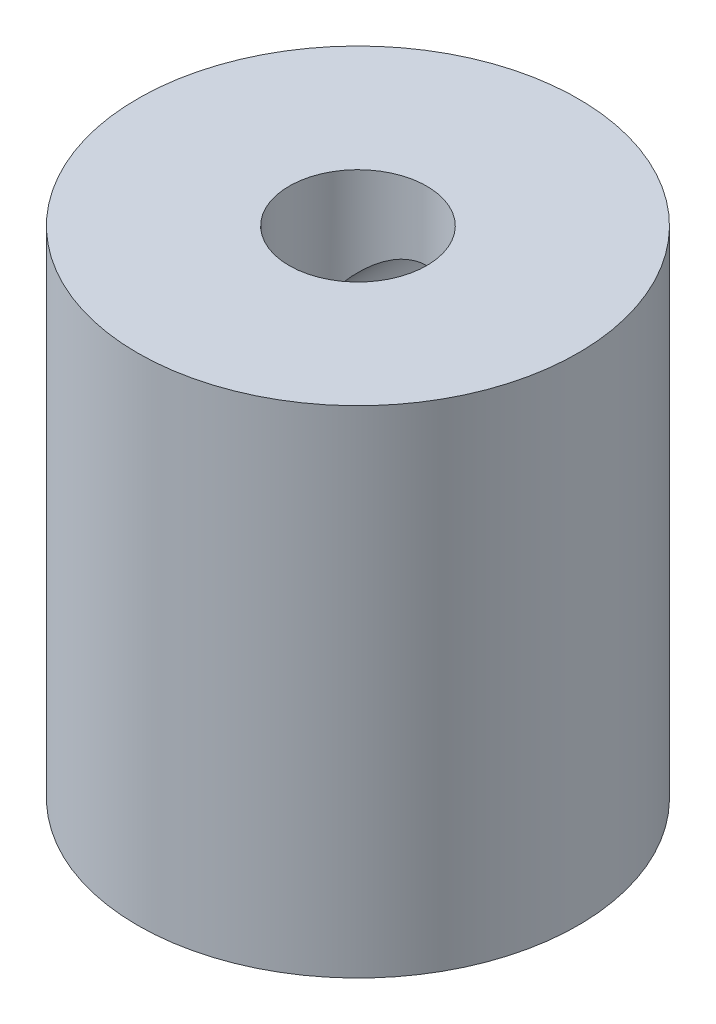
from build123d import *

# Parameters (mm, degrees)
ESBO_O1_R                = 4
ESBO_O1_R_2              = 1.25
RESSALTO_EXTRUS_O1_DEPTH = 9
ESBO_O2_R                = 1.25
CORTE_EXTRUS_O1_DEPTH    = 9


with BuildPart() as part:
    # Esboço1 → Ressalto-extrusão1 (new body)
    with BuildSketch(Plane(origin=(0, 0, 0), x_dir=(1, 0, 0), z_dir=(0, 1, 0))):
        with Locations(Location((0, 0, 0), (0, 0, 270))):
            Circle(ESBO_O1_R)
        with Locations(Location((0, 0, 0), (0, 0, 270))):
            Circle(ESBO_O1_R_2, mode=Mode.SUBTRACT)
    extrude(amount=RESSALTO_EXTRUS_O1_DEPTH)

    # Esboço2 → Corte-extrusão1 (cut)
    with BuildSketch(Plane.XY):
        with Locations((0, 6.5)):
            Circle(ESBO_O2_R)
        with Locations((0, 2.5)):
            Circle(ESBO_O2_R)
    extrude(amount=-CORTE_EXTRUS_O1_DEPTH, mode=Mode.SUBTRACT)


solid = part.part
